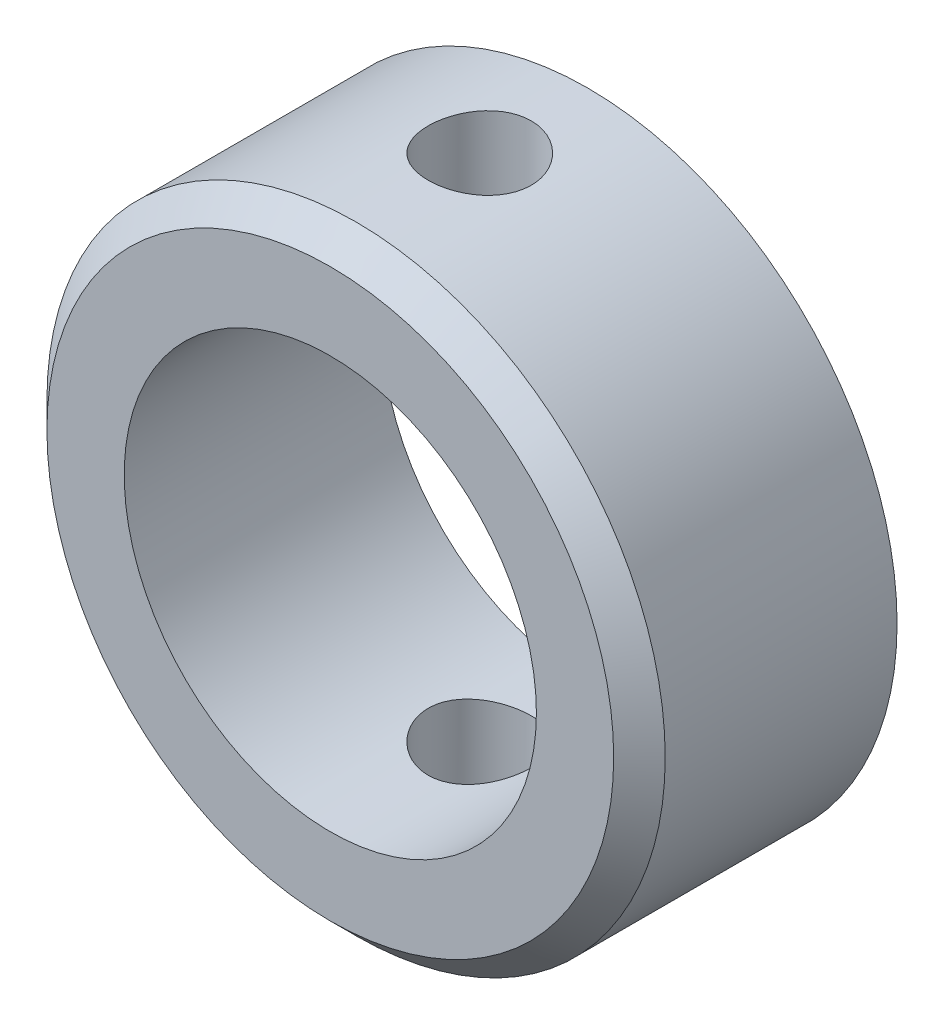
from build123d import *

# Parameters (mm, degrees)
SKETCH1_R           = 12
SKETCH1_R_2         = 8
BOSS_EXTRUDE1_DEPTH = 10
CHAMFER1_SIZE       = 1
SKETCH2_R           = 2
CUT_EXTRUDE1_DEPTH  = 27


with BuildPart() as part:
    # Sketch1 → Boss-Extrude1 (new body)
    with BuildSketch(Plane.XY):
        Circle(SKETCH1_R)
        Circle(SKETCH1_R_2, mode=Mode.SUBTRACT)
    extrude(amount=BOSS_EXTRUDE1_DEPTH)

    # Chamfer1
    chamfer1_edges = [part.edges().sort_by_distance(p)[0] for p in [
        (-12, 0, 10),
    ]]
    chamfer(chamfer1_edges, length=CHAMFER1_SIZE)

    # Sketch2 → Cut-Extrude1 (cut, symmetric)
    with BuildSketch(Plane(origin=(0, 0, 0), x_dir=(1, 0, 0), z_dir=(0, 1, 0))):
        with Locations(Location((0, -4.2, 0), (0, 0, 270))):
            Circle(SKETCH2_R)
    extrude(amount=CUT_EXTRUDE1_DEPTH, both=True, mode=Mode.SUBTRACT)


solid = part.part
